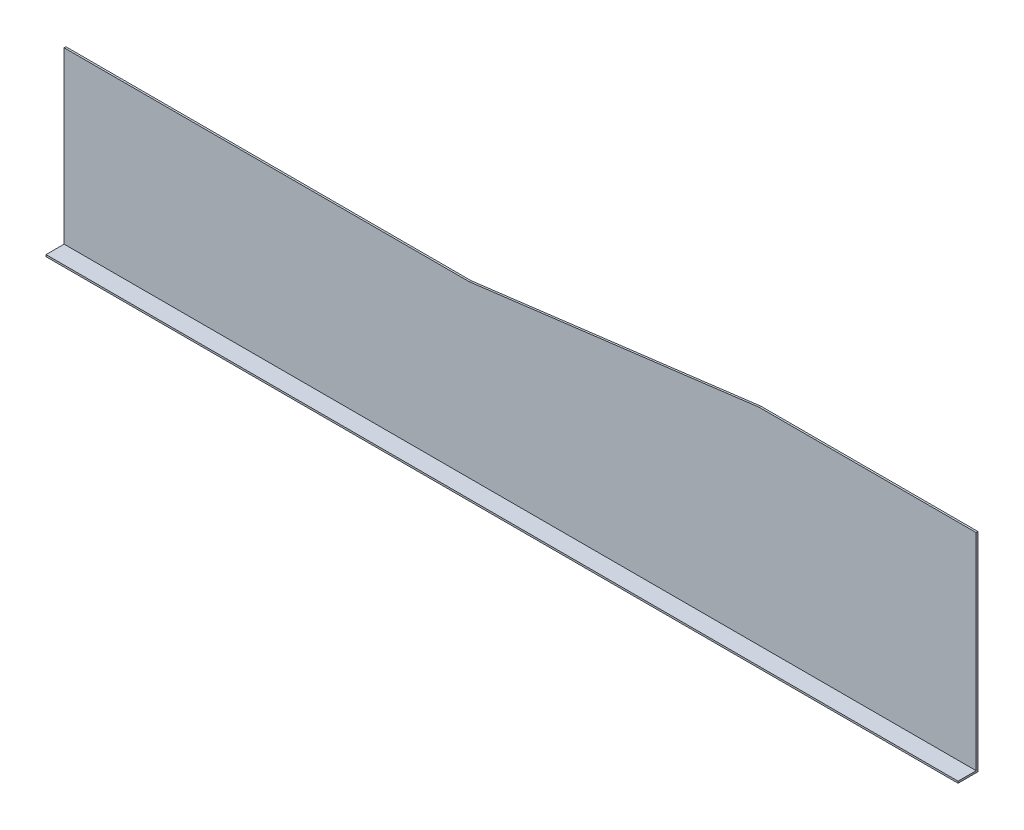
from build123d import *

# Parameters (mm, degrees)
BOSS_EXTRUDE1_DEPTH = 1.27
SKETCH2_W           = 630
SKETCH2_H           = 1.27
BOSS_EXTRUDE2_DEPTH = 12.5


with BuildPart() as part:
    # Sketch1 → Boss-Extrude1 (new body)
    with BuildSketch(Plane.XY):
        Polygon((0, 0), (0, 118.73), (280, 118.73), (480, 143.73), (630, 143.73), (630, 0), align=None)
    extrude(amount=BOSS_EXTRUDE1_DEPTH)

    # Sketch2 → Boss-Extrude2 (add)
    with BuildSketch(Plane.XY.offset(1.27)):
        with Locations((315, 0.635)):
            Rectangle(SKETCH2_W, SKETCH2_H)
    extrude(amount=BOSS_EXTRUDE2_DEPTH)


solid = part.part
